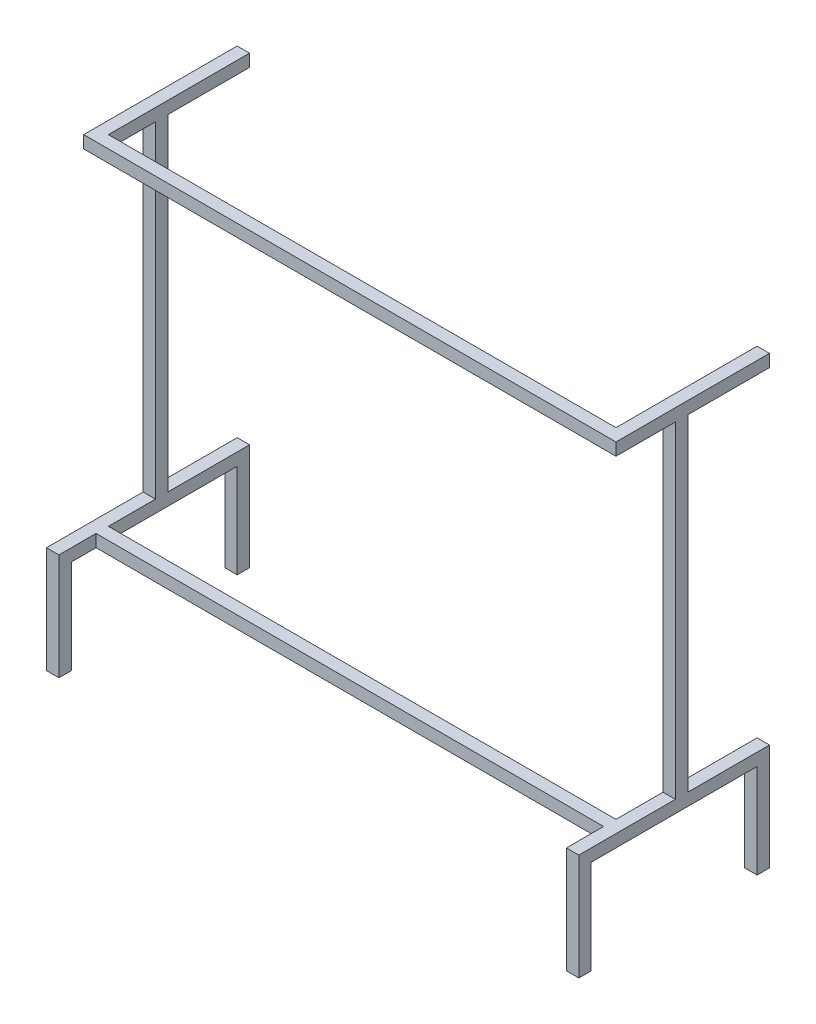
from build123d import *

# Parameters (mm, degrees)
SKETCH1_W             = 1075
SKETCH1_H             = 25
BOSS_EXTRUDE1_DEPTH   = 25
BOSS_EXTRUDE1_2_DEPTH = 25
SKETCH2_W             = 25
SKETCH2_H             = 25
BOSS_EXTRUDE2_DEPTH   = 285
BOSS_EXTRUDE3_REACH   = 918.164
SKETCH3_W             = 25
SKETCH3_H             = 25
SKETCH4_W             = 25
SKETCH4_H             = 25
BOSS_EXTRUDE4_DEPTH   = 75
SKETCH5_W             = 25
SKETCH5_H             = 25
BOSS_EXTRUDE5_DEPTH   = 190


with BuildPart() as part:
    # Sketch1 → Boss-Extrude1 (new body)
    with BuildSketch(Plane.XY):
        with Locations((0, -342.5)):
            Rectangle(SKETCH1_W, SKETCH1_H)
    extrude(amount=BOSS_EXTRUDE1_DEPTH)



with BuildPart() as body_2:
    # Sketch1 → Boss-Extrude1 2 (new body)
    with BuildSketch(Plane.XY):
        with Locations((0, 342.5)):
            Rectangle(SKETCH1_W, SKETCH1_H)
    extrude(amount=BOSS_EXTRUDE1_2_DEPTH)


with BuildPart() as part_1:
    add(part.part)

    add(body_2.part)  # Boss-Extrude2 merges body 2
    # Sketch2 → Boss-Extrude2 (add)
    with BuildSketch(Plane(origin=(0, 0, 0), x_dir=(-1, 0, 0), z_dir=(0, 0, -1))):
        with Locations((-525, 342.5)):
            Rectangle(SKETCH2_W, SKETCH2_H)
        with Locations((525, 342.5)):
            Rectangle(SKETCH2_W, SKETCH2_H)
        with Locations((525, -342.5)):
            Rectangle(SKETCH2_W, SKETCH2_H)
        with Locations((-525, -342.5)):
            Rectangle(SKETCH2_W, SKETCH2_H)
    extrude(amount=BOSS_EXTRUDE2_DEPTH)

    # Sketch3 → Boss-Extrude3 (add, up to next)
    with BuildSketch(Plane(origin=(0, -330, 0), x_dir=(1, 0, 0), z_dir=(0, 1, 0)), mode=Mode.PRIVATE) as boss_extrude3_sk1:
        with Locations((-525, 107.5)):
            Rectangle(SKETCH3_W, SKETCH3_H)
    boss_extrude3_tool1 = extrude(boss_extrude3_sk1.sketch, amount=BOSS_EXTRUDE3_REACH, mode=Mode.PRIVATE) - part_1.part
    # Sketch3 → Boss-Extrude3 (add, up to next)
    with BuildSketch(Plane(origin=(0, -330, 0), x_dir=(1, 0, 0), z_dir=(0, 1, 0)), mode=Mode.PRIVATE) as boss_extrude3_sk2:
        with Locations((525, 107.5)):
            Rectangle(SKETCH3_W, SKETCH3_H)
    boss_extrude3_tool2 = extrude(boss_extrude3_sk2.sketch, amount=BOSS_EXTRUDE3_REACH, mode=Mode.PRIVATE) - part_1.part
    add(boss_extrude3_tool1.solids().sort_by_distance((-525, -330, -107.5))[0])
    add(boss_extrude3_tool2.solids().sort_by_distance((525, -330, -107.5))[0])

    # Sketch4 → Boss-Extrude4 (add)
    with BuildSketch(Plane.XY.offset(25)):
        with Locations((-525, -342.5)):
            Rectangle(SKETCH4_W, SKETCH4_H)
        with Locations((525, -342.5)):
            Rectangle(SKETCH4_W, SKETCH4_H)
    extrude(amount=BOSS_EXTRUDE4_DEPTH)

    # Sketch5 → Boss-Extrude5 (add)
    with BuildSketch(Plane.XZ.offset(355)):
        with Locations((-525, -272.5)):
            Rectangle(SKETCH5_W, SKETCH5_H)
        with Locations((-525, 87.5)):
            Rectangle(SKETCH5_W, SKETCH5_H)
        with Locations((525, 87.5)):
            Rectangle(SKETCH5_W, SKETCH5_H)
        with Locations((525, -272.5)):
            Rectangle(SKETCH5_W, SKETCH5_H)
    extrude(amount=BOSS_EXTRUDE5_DEPTH)


solid = part_1.part
